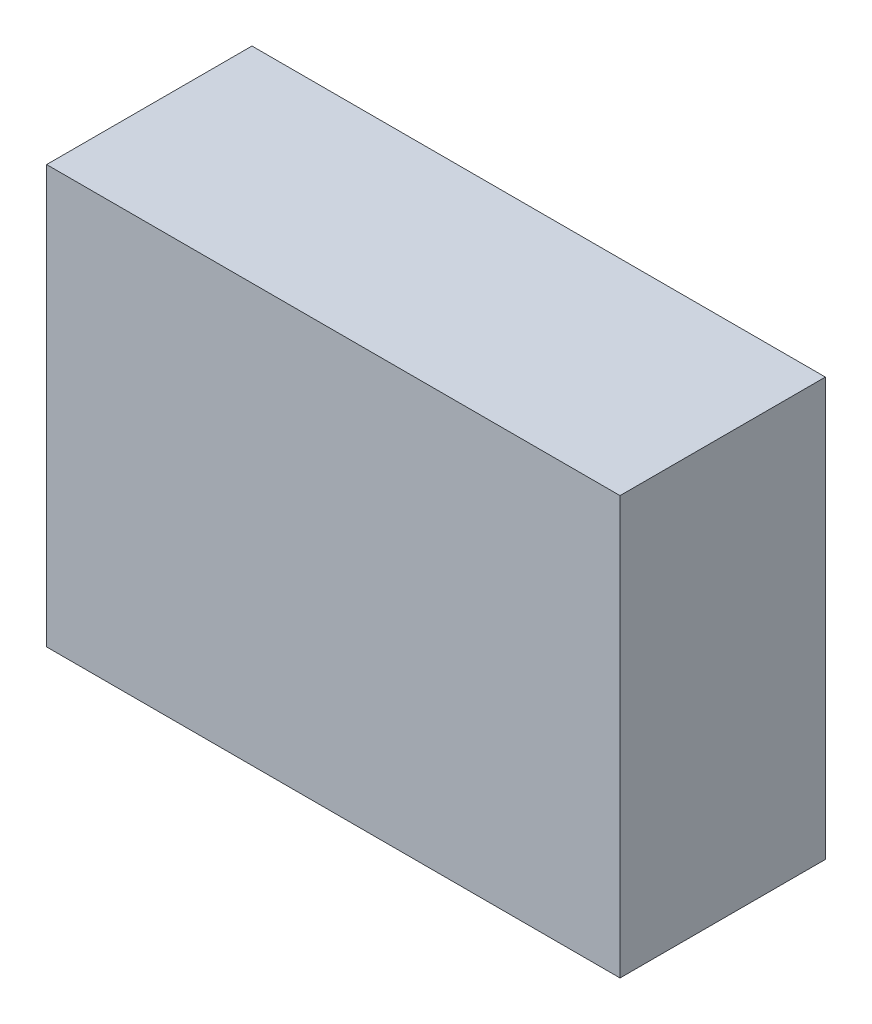
from build123d import *

# Parameters (mm, degrees)
SKETCH1_W           = 21
SKETCH1_H           = 15.3
BOSS_EXTRUDE1_DEPTH = 3.76


with BuildPart() as part:
    # Sketch1 → Boss-Extrude1 (new, symmetric)
    with BuildSketch(Plane.XY):
        Rectangle(SKETCH1_W, SKETCH1_H)
    extrude(amount=BOSS_EXTRUDE1_DEPTH, both=True)


solid = part.part
